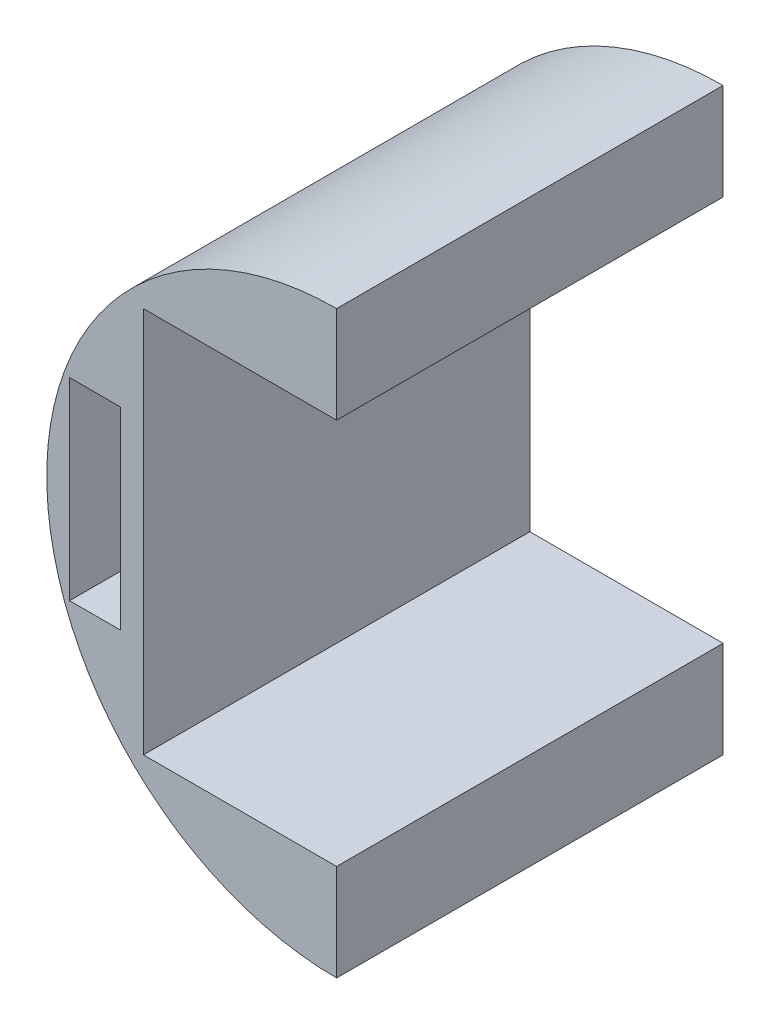
from build123d import *

# Parameters (mm, degrees)
BOSS_EXTRUDE1_DEPTH = 20
SKETCH2_W           = 2.639320226
SKETCH2_H           = 10
CUT_EXTRUDE1_DEPTH  = 20


with BuildPart() as part:
    # Sketch1 → Boss-Extrude1 (new body)
    with BuildSketch(Plane(origin=(0, 0, 0), x_dir=(0, 1, 0), z_dir=(0, 0, 1))):
        with BuildLine():
            Line((0, 0), (5, 0))
            Line((5, 0), (5, 10))
            Line((5, 10), (25, 10))
            Line((25, 10), (25, 0))
            Line((25, 0), (30, 0))
            ThreePointArc((30, 0), (15, 15), (0, 0))
        make_face()
    extrude(amount=BOSS_EXTRUDE1_DEPTH)

    # Sketch2 → Cut-Extrude1 (cut)
    with BuildSketch(Plane.XY.offset(20)):
        with Locations((-12.5, 15)):
            Rectangle(SKETCH2_W, SKETCH2_H)
    extrude(amount=-CUT_EXTRUDE1_DEPTH, mode=Mode.SUBTRACT)


solid = part.part
